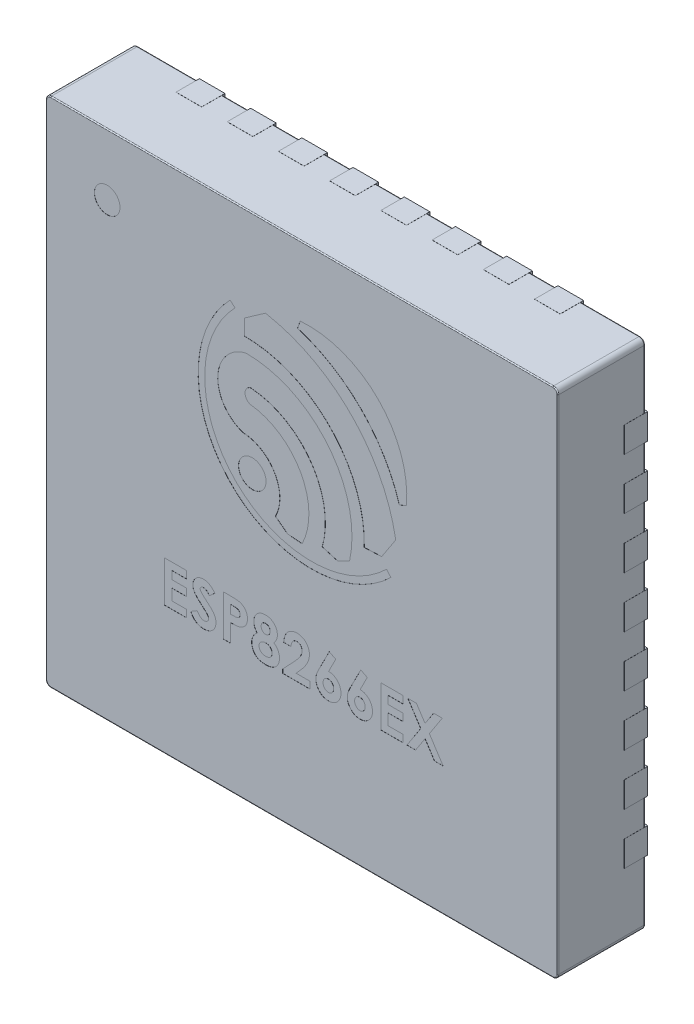
from build123d import *

# Parameters (mm, degrees)
SKETCH1_W                = 5
SKETCH1_H                = 5
BOSS_EXTRUDE1_DEPTH      = 0.85
FILLET1_R                = 0.05
FILLET2_R                = 0.01
BOSS_EXTRUDE2_DEPTH      = 0.025
BOSS_EXTRUDE2_DEPTH_BACK = 0.203
SKETCH2_W                = 0.25
SKETCH2_H                = 0.4
SKETCH2_W_2              = 0.4
SKETCH2_H_2              = 0.25
SKETCH3_R                = 0.125
SKETCH3_R_2              = 0.134340001
CUT_EXTRUDE1_DEPTH       = 0.001
BODY_MOVE_COPY1_ANGLE    = 180


with BuildPart() as part:
    # Sketch1 → Boss-Extrude1 (new body)
    with BuildSketch(Plane(origin=(0, 0, 0), x_dir=(1, 0, 0), z_dir=(0, 1, 0))):
        Rectangle(SKETCH1_W, SKETCH1_H)
    extrude(amount=BOSS_EXTRUDE1_DEPTH)

    # Fillet1
    fillet1_edges = [part.edges().sort_by_distance(p)[0] for p in [
        (2.5, 0.425, 2.5),
        (-2.5, 0.425, 2.5),
        (-2.5, 0.425, -2.5),
        (2.5, 0.425, -2.5),
    ]]
    fillet(fillet1_edges, radius=FILLET1_R)

    # Fillet2
    fillet2_edges = [part.edges().sort_by_distance(p)[0] for p in [
        (0, 0, -2.5),
        (0, 0.85, -2.5),
        (2.5, 0, 0),
        (0, 0, 2.5),
        (-2.5, 0, 0),
        (-2.485355339, 0, -2.485355339),
        (-2.485355339, 0, 2.485355339),
        (2.485355339, 0, 2.485355339),
        (2.485355339, 0, -2.485355339),
        (2.5, 0.85, 0),
        (-2.5, 0.85, 0),
        (0, 0.85, 2.5),
        (-2.485355339, 0.85, -2.485355339),
        (-2.485355339, 0.85, 2.485355339),
        (2.485355339, 0.85, 2.485355339),
        (2.485355339, 0.85, -2.485355339),
    ]]
    fillet(fillet2_edges, radius=FILLET2_R)

    # Sketch2 → Boss-Extrude2 (add, two sides: drawn at the far end of the back side and taken through both)
    with BuildSketch(Plane.XZ.offset(-BOSS_EXTRUDE2_DEPTH_BACK)):
        with BuildLine():
            Line((1.55, 1.85), (1.85, 1.55))
            Line((1.85, 1.55), (1.85, -1.8))
            ThreePointArc((1.85, -1.8), (1.835355339, -1.835355339), (1.8, -1.85))
            Line((1.8, -1.85), (-1.8, -1.85))
            ThreePointArc((-1.8, -1.85), (-1.835355339, -1.835355339), (-1.85, -1.8))
            Line((-1.85, -1.8), (-1.85, 1.8))
            ThreePointArc((-1.85, 1.8), (-1.835355339, 1.835355339), (-1.8, 1.85))
            Line((-1.8, 1.85), (1.55, 1.85))
        make_face()
        with Locations((-0.25, 2.301)):
            Rectangle(SKETCH2_W, SKETCH2_H)
        with Locations((-0.75, 2.301)):
            Rectangle(SKETCH2_W, SKETCH2_H)
        with Locations((-1.25, 2.301)):
            Rectangle(SKETCH2_W, SKETCH2_H)
        with Locations((-1.75, 2.301)):
            Rectangle(SKETCH2_W, SKETCH2_H)
        with Locations((1.75, 2.301)):
            Rectangle(SKETCH2_W, SKETCH2_H)
        with Locations((1.25, 2.301)):
            Rectangle(SKETCH2_W, SKETCH2_H)
        with Locations((0.75, 2.301)):
            Rectangle(SKETCH2_W, SKETCH2_H)
        with Locations((0.25, 2.301)):
            Rectangle(SKETCH2_W, SKETCH2_H)
        with Locations((0.25, -2.301)):
            Rectangle(SKETCH2_W, SKETCH2_H)
        with Locations((0.75, -2.301)):
            Rectangle(SKETCH2_W, SKETCH2_H)
        with Locations((1.25, -2.301)):
            Rectangle(SKETCH2_W, SKETCH2_H)
        with Locations((1.75, -2.301)):
            Rectangle(SKETCH2_W, SKETCH2_H)
        with Locations((-1.75, -2.301)):
            Rectangle(SKETCH2_W, SKETCH2_H)
        with Locations((-1.25, -2.301)):
            Rectangle(SKETCH2_W, SKETCH2_H)
        with Locations((-0.75, -2.301)):
            Rectangle(SKETCH2_W, SKETCH2_H)
        with Locations((-0.25, -2.301)):
            Rectangle(SKETCH2_W, SKETCH2_H)
        with Locations((2.301, 0.25)):
            Rectangle(SKETCH2_W_2, SKETCH2_H_2)
        with Locations((2.301, 0.75)):
            Rectangle(SKETCH2_W_2, SKETCH2_H_2)
        with Locations((2.301, 1.25)):
            Rectangle(SKETCH2_W_2, SKETCH2_H_2)
        with Locations((2.301, 1.75)):
            Rectangle(SKETCH2_W_2, SKETCH2_H_2)
        with Locations((2.301, -1.75)):
            Rectangle(SKETCH2_W_2, SKETCH2_H_2)
        with Locations((2.301, -1.25)):
            Rectangle(SKETCH2_W_2, SKETCH2_H_2)
        with Locations((2.301, -0.75)):
            Rectangle(SKETCH2_W_2, SKETCH2_H_2)
        with Locations((2.301, -0.25)):
            Rectangle(SKETCH2_W_2, SKETCH2_H_2)
        with Locations((-2.301, -0.25)):
            Rectangle(SKETCH2_W_2, SKETCH2_H_2)
        with Locations((-2.301, -0.75)):
            Rectangle(SKETCH2_W_2, SKETCH2_H_2)
        with Locations((-2.301, -1.25)):
            Rectangle(SKETCH2_W_2, SKETCH2_H_2)
        with Locations((-2.301, -1.75)):
            Rectangle(SKETCH2_W_2, SKETCH2_H_2)
        with Locations((-2.301, 1.75)):
            Rectangle(SKETCH2_W_2, SKETCH2_H_2)
        with Locations((-2.301, 1.25)):
            Rectangle(SKETCH2_W_2, SKETCH2_H_2)
        with Locations((-2.301, 0.75)):
            Rectangle(SKETCH2_W_2, SKETCH2_H_2)
        with Locations((-2.301, 0.25)):
            Rectangle(SKETCH2_W_2, SKETCH2_H_2)
    extrude(amount=BOSS_EXTRUDE2_DEPTH + BOSS_EXTRUDE2_DEPTH_BACK)

    # Sketch3 → Cut-Extrude1 (cut)
    # profile 1 of 15: a face of its own
    with BuildSketch(Plane(origin=(0, 0.85, 0), x_dir=(1, 0, 0), z_dir=(0, 1, 0))):
        with Locations(Location((1.9, -1.9, 0), (0, 0, 270))):
            Circle(SKETCH3_R)
    # profile 2 of 15: a face of its own
    with BuildSketch(Plane(origin=(0, 0.85, 0), x_dir=(1, 0, 0), z_dir=(0, 1, 0))):
        with Locations(Location((0.483594139, -0.295042575, 0), (0, 0, 270))):
            Circle(SKETCH3_R_2)
    # profile 3 of 15: a face of its own
    with BuildSketch(Plane(origin=(0, 0.85, 0), x_dir=(1, 0, 0), z_dir=(0, 1, 0))):
        with BuildLine():
            Line((-0.951785861, -0.747131021), (-1.020815861, -0.776531021))
            ThreePointArc((-1.020815861, -0.776531021), (-0.744879335, -1.538615836), (0.015772809, -1.818477493))
            Line((0.015772809, -1.818477493), (0.042084139, -1.745141021))
            ThreePointArc((0.042084139, -1.745141021), (-0.579273267, -1.370042291), (-0.951785861, -0.747131021))
        make_face()
    # profile 4 of 15: a face of its own
    with BuildSketch(Plane(origin=(0, 0.85, 0), x_dir=(1, 0, 0), z_dir=(0, 1, 0))):
        with BuildLine():
            Line((-0.608885862, -0.217240217), (-0.779015862, -0.224530217))
            Line((-0.779015862, -0.224530217), (-0.916505862, -0.434440217))
            ThreePointArc((-0.916505862, -0.434440217), (-0.482429799, -1.275536784), (0.355366094, -1.715949664))
            Line((0.355366094, -1.715949664), (0.561766094, -1.571139664))
            Line((0.561766094, -1.571139664), (0.561766094, -1.419009664))
            ThreePointArc((0.561766094, -1.419009664), (-0.277433802, -1.065425286), (-0.608885862, -0.217240217))
        make_face()
    # profile 5 of 15: a face of its own
    with BuildSketch(Plane(origin=(0, 0.85, 0), x_dir=(1, 0, 0), z_dir=(0, 1, 0))):
        with BuildLine():
            Line((0.652194139, -1.611641021), (0.700284139, -1.654181021))
            ThreePointArc((0.700284139, -1.654181021), (0.685311706, -0.099263955), (-0.869668762, -0.094067666))
            Line((-0.869668762, -0.094067666), (-0.826901773, -0.141962742))
            ThreePointArc((-0.826901773, -0.141962742), (0.64006638, -0.144720408), (0.652194139, -1.611641021))
        make_face()
    # profile 6 of 15: a face of its own
    with BuildSketch(Plane(origin=(0, 0.85, 0), x_dir=(1, 0, 0), z_dir=(0, 1, 0))):
        with BuildLine():
            Line((0.257726542, -0.047166837), (0.139346542, 0.042413163))
            Line((0.139346542, 0.042413163), (-0.002793458, 0.054923163))
            ThreePointArc((-0.002793458, 0.054923163), (0.010161928, -0.539574072), (0.504116848, -0.870638026))
            ThreePointArc((0.504116848, -0.870638026), (0.554404737, -0.94213728), (0.501462863, -1.011694256))
            ThreePointArc((0.501462863, -1.011694256), (-0.086844469, -0.682432252), (-0.198992375, -0.017645195))
            Line((-0.198992375, -0.017645195), (-0.349232375, 0.027084805))
            Line((-0.349232375, 0.027084805), (-0.466280352, -0.031499116))
            ThreePointArc((-0.466280352, -0.031499116), (-0.259791749, -0.898754897), (0.544527625, -1.283255195))
            ThreePointArc((0.544527625, -1.283255195), (0.820500189, -0.950984657), (0.574016431, -0.596287147))
            ThreePointArc((0.574016431, -0.596287147), (0.26490491, -0.408682802), (0.257726542, -0.047166837))
        make_face()
    # profile 7 of 15: a face of its own
    with BuildSketch(Plane(origin=(0, 0.85, 0), x_dir=(1, 0, 0), z_dir=(0, 1, 0))):
        Polygon((-1.034535256, 0.845), (-1.119150641, 0.845), (-1.202724359, 0.973445513), (-1.286458333, 0.845), (-1.371153846, 0.845), (-1.245032051, 1.038429487), (-1.379487179, 1.245), (-1.294871795, 1.245), (-1.202724359, 1.103333333), (-1.110336538, 1.245), (-1.025641026, 1.245), (-1.160416667, 1.038349359), align=None)
    # profile 8 of 15: a face of its own
    with BuildSketch(Plane(origin=(0, 0.85, 0), x_dir=(1, 0, 0), z_dir=(0, 1, 0))):
        Polygon((-0.771794872, 0.845), (-0.987179487, 0.845), (-0.987179487, 0.916794872), (-0.843589744, 0.916794872), (-0.843589744, 0.993717949), (-0.987179487, 0.993717949), (-0.987179487, 1.065512821), (-0.843589744, 1.065512821), (-0.843589744, 1.173205128), (-0.987179487, 1.173205128), (-0.987179487, 1.245), (-0.771794872, 1.245), align=None)
    # profile 9 of 15: a face of its own
    with BuildSketch(Plane(origin=(0, 0.85, 0), x_dir=(1, 0, 0), z_dir=(0, 1, 0))):
        with BuildLine():
            Line((-0.575320513, 0.83474359), (-0.638862179, 0.866955128))
            Line((-0.638862179, 0.866955128), (-0.569150641, 1.003974359))
            add(Edge.make_bspline(
                [(-0.569150641, 1.003974359), (-0.573269435, 1.004080212), (-0.581382076, 1.004288707), (-0.593312977, 1.005997299), (-0.604748106, 1.008892993), (-0.615686991, 1.012934092), (-0.626207755, 1.018011084), (-0.636259324, 1.024259257), (-0.645707861, 1.031826822), (-0.65472964, 1.040226728), (-0.662934783, 1.049528342), (-0.670061962, 1.059524346), (-0.676273288, 1.069970201), (-0.681101695, 1.081099959), (-0.684996456, 1.09272904), (-0.687806696, 1.104903955), (-0.689410017, 1.117659953), (-0.689631062, 1.12632568), (-0.68974359, 1.130737179)],
                knots=[0, 0, 0, 0, 1.013301021, 1.995862538, 2.958769729, 3.911210226, 4.860765807, 5.829243184, 6.816804824, 7.835209597, 8.859810738, 9.863084768, 10.852896952, 11.844649668, 12.842374562, 13.8676291, 14.914464604, 16, 16, 16, 16], degree=3))
            add(Edge.make_bspline(
                [(-0.68974359, 1.130737179), (-0.689637782, 1.134989455), (-0.689428647, 1.14339438), (-0.687710912, 1.155741551), (-0.684901826, 1.167603001), (-0.680987758, 1.178950557), (-0.6758446, 1.189745756), (-0.669797074, 1.200156632), (-0.662408424, 1.209950659), (-0.654060686, 1.219168683), (-0.644924818, 1.227601632), (-0.635232355, 1.235016234), (-0.625027455, 1.241214134), (-0.614441239, 1.246419225), (-0.60328236, 1.250308145), (-0.591712075, 1.253242307), (-0.579644191, 1.254935738), (-0.571452764, 1.255148664), (-0.567307692, 1.25525641)],
                knots=[0, 0, 0, 0, 1.049794856, 2.07499426, 3.07172498, 4.056334273, 5.03302406, 6.020611576, 7.024540571, 8.056592197, 9.088222165, 10.090850172, 11.06486348, 12.032490482, 12.998429859, 13.977500003, 14.976563331, 16, 16, 16, 16], degree=3))
            add(Edge.make_bspline(
                [(-0.567307692, 1.25525641), (-0.562973519, 1.255167196), (-0.554450954, 1.254991767), (-0.541975055, 1.253055996), (-0.530038648, 1.250086141), (-0.518593103, 1.246052568), (-0.507780989, 1.240577821), (-0.497510034, 1.234017592), (-0.487821261, 1.226220723), (-0.478777792, 1.217420685), (-0.470631959, 1.207777303), (-0.463366119, 1.197766021), (-0.457219317, 1.187369835), (-0.452243597, 1.176600195), (-0.448361432, 1.165491332), (-0.445660235, 1.154022185), (-0.443900156, 1.142223171), (-0.443693827, 1.134215692), (-0.443589744, 1.130176282)],
                knots=[0, 0, 0, 0, 1.063729824, 2.091680771, 3.092458079, 4.082252707, 5.065066109, 6.062289472, 7.070414589, 8.114214813, 9.156632944, 10.167081891, 11.149282074, 12.117871028, 13.076366051, 14.034232288, 15.008359245, 16, 16, 16, 16], degree=3))
            add(Edge.make_bspline(
                [(-0.443589744, 1.130176282), (-0.443644737, 1.127048231), (-0.443755031, 1.120774716), (-0.444863486, 1.111380483), (-0.446548568, 1.10196153), (-0.448502302, 1.094013716), (-0.450512838, 1.087292523), (-0.45254048, 1.081606191), (-0.455026038, 1.07531108), (-0.457955206, 1.068384327), (-0.461206501, 1.060771365), (-0.464986073, 1.052561472), (-0.46917084, 1.043689163), (-0.472160237, 1.037597378), (-0.473717949, 1.034423077)],
                knots=[0, 0, 0, 0, 1.110459156, 2.227099586, 3.354645278, 4.50724841, 5.131424341, 5.845429508, 6.650417918, 7.534765369, 8.5162346, 9.590157747, 10.744282107, 12, 12, 12, 12], degree=3))
            Line((-0.473717949, 1.034423077), (-0.575320513, 0.83474359))
        make_face()
        with BuildLine():
            add(Edge.make_bspline(
                [(-0.565705128, 1.070641026), (-0.562260477, 1.070799358), (-0.555519748, 1.071109194), (-0.545930592, 1.074342833), (-0.537222315, 1.079431029), (-0.529594971, 1.086419489), (-0.523262298, 1.094894764), (-0.518644785, 1.104580774), (-0.51582257, 1.11530185), (-0.515533725, 1.12278674), (-0.515384615, 1.126650641)],
                knots=[0, 0, 0, 0, 0.981531227, 1.92072777, 2.858278205, 3.847411092, 4.856727683, 5.864107753, 6.897395173, 8, 8, 8, 8], degree=3))
            add(Edge.make_bspline(
                [(-0.515384615, 1.126650641), (-0.515565597, 1.130513946), (-0.515917617, 1.138028333), (-0.518777299, 1.148842121), (-0.523687846, 1.158621674), (-0.530344764, 1.167158902), (-0.538058328, 1.174406999), (-0.546773681, 1.17963065), (-0.556161705, 1.182869927), (-0.562661724, 1.183262973), (-0.565945513, 1.183461538)],
                knots=[0, 0, 0, 0, 1.098824389, 2.137286887, 3.15751972, 4.193305908, 5.205115386, 6.153224686, 7.067015188, 8, 8, 8, 8], degree=3))
            add(Edge.make_bspline(
                [(-0.565945513, 1.183461538), (-0.56941302, 1.18325884), (-0.576213404, 1.182861313), (-0.586023703, 1.179766648), (-0.594984267, 1.174595406), (-0.602911865, 1.167508929), (-0.609688285, 1.159052236), (-0.614460726, 1.149159341), (-0.617451173, 1.1382561), (-0.617779529, 1.130597057), (-0.617948718, 1.126650641)],
                knots=[0, 0, 0, 0, 0.969156912, 1.90068503, 2.84824055, 3.843957741, 4.860802806, 5.860356532, 6.897522282, 8, 8, 8, 8], degree=3))
            add(Edge.make_bspline(
                [(-0.617948718, 1.126650641), (-0.617773404, 1.122785442), (-0.617433578, 1.115293221), (-0.614522926, 1.104576059), (-0.609832771, 1.09486558), (-0.603320953, 1.086391424), (-0.595435043, 1.079370329), (-0.58634014, 1.074342684), (-0.576337943, 1.07110007), (-0.56930973, 1.070796645), (-0.565705128, 1.070641026)],
                knots=[0, 0, 0, 0, 1.083267085, 2.099782405, 3.092211101, 4.09231173, 5.080341908, 6.03348511, 6.991421775, 8, 8, 8, 8], degree=3))
        make_face(mode=Mode.SUBTRACT)
    # profile 10 of 15: a face of its own
    with BuildSketch(Plane(origin=(0, 0.85, 0), x_dir=(1, 0, 0), z_dir=(0, 1, 0))):
        with BuildLine():
            Line((-0.267628205, 0.83474359), (-0.331169872, 0.866955128))
            Line((-0.331169872, 0.866955128), (-0.261458333, 1.003974359))
            add(Edge.make_bspline(
                [(-0.261458333, 1.003974359), (-0.265577128, 1.004080212), (-0.273689768, 1.004288707), (-0.285620669, 1.005997299), (-0.297055799, 1.008892993), (-0.307994684, 1.012934092), (-0.318515447, 1.018011084), (-0.328567017, 1.024259257), (-0.338015554, 1.031826822), (-0.347037332, 1.040226728), (-0.355242475, 1.049528342), (-0.362369654, 1.059524346), (-0.36858098, 1.069970201), (-0.373409387, 1.081099959), (-0.377304149, 1.09272904), (-0.380114389, 1.104903955), (-0.381717709, 1.117659953), (-0.381938754, 1.12632568), (-0.382051282, 1.130737179)],
                knots=[0, 0, 0, 0, 1.013301021, 1.995862538, 2.958769729, 3.911210226, 4.860765807, 5.829243184, 6.816804824, 7.835209597, 8.859810738, 9.863084768, 10.852896952, 11.844649668, 12.842374562, 13.8676291, 14.914464604, 16, 16, 16, 16], degree=3))
            add(Edge.make_bspline(
                [(-0.382051282, 1.130737179), (-0.381945475, 1.134989455), (-0.381736339, 1.14339438), (-0.380018604, 1.155741551), (-0.377209518, 1.167603001), (-0.37329545, 1.178950557), (-0.368152292, 1.189745756), (-0.362104766, 1.200156632), (-0.354716117, 1.209950659), (-0.346368378, 1.219168683), (-0.337232511, 1.227601632), (-0.327540047, 1.235016234), (-0.317335147, 1.241214134), (-0.306748932, 1.246419225), (-0.295590053, 1.250308145), (-0.284019767, 1.253242307), (-0.271951884, 1.254935738), (-0.263760456, 1.255148664), (-0.259615385, 1.25525641)],
                knots=[0, 0, 0, 0, 1.049794856, 2.07499426, 3.07172498, 4.056334273, 5.03302406, 6.020611576, 7.024540571, 8.056592197, 9.088222165, 10.090850172, 11.06486348, 12.032490482, 12.998429859, 13.977500003, 14.976563331, 16, 16, 16, 16], degree=3))
            add(Edge.make_bspline(
                [(-0.259615385, 1.25525641), (-0.255281211, 1.255167196), (-0.246758646, 1.254991767), (-0.234282747, 1.253055996), (-0.22234634, 1.250086141), (-0.210900795, 1.246052568), (-0.200088682, 1.240577821), (-0.189817727, 1.234017592), (-0.180128953, 1.226220723), (-0.171085484, 1.217420685), (-0.162939651, 1.207777303), (-0.155673811, 1.197766021), (-0.149527009, 1.187369835), (-0.144551289, 1.176600195), (-0.140669124, 1.165491332), (-0.137967927, 1.154022185), (-0.136207849, 1.142223171), (-0.13600152, 1.134215692), (-0.135897436, 1.130176282)],
                knots=[0, 0, 0, 0, 1.063729824, 2.091680771, 3.092458079, 4.082252707, 5.065066109, 6.062289472, 7.070414589, 8.114214813, 9.156632944, 10.167081891, 11.149282074, 12.117871028, 13.076366051, 14.034232288, 15.008359245, 16, 16, 16, 16], degree=3))
            add(Edge.make_bspline(
                [(-0.135897436, 1.130176282), (-0.13595243, 1.127048231), (-0.136062723, 1.120774716), (-0.137171179, 1.111380483), (-0.13885626, 1.10196153), (-0.140809995, 1.094013716), (-0.14282053, 1.087292523), (-0.144848173, 1.081606191), (-0.147333731, 1.07531108), (-0.150262898, 1.068384327), (-0.153514193, 1.060771365), (-0.157293766, 1.052561472), (-0.161478532, 1.043689163), (-0.164467929, 1.037597378), (-0.166025641, 1.034423077)],
                knots=[0, 0, 0, 0, 1.110459156, 2.227099586, 3.354645278, 4.50724841, 5.131424341, 5.845429508, 6.650417918, 7.534765369, 8.5162346, 9.590157747, 10.744282107, 12, 12, 12, 12], degree=3))
            Line((-0.166025641, 1.034423077), (-0.267628205, 0.83474359))
        make_face()
        with BuildLine():
            add(Edge.make_bspline(
                [(-0.258012821, 1.070641026), (-0.25456817, 1.070799358), (-0.24782744, 1.071109194), (-0.238238284, 1.074342833), (-0.229530007, 1.079431029), (-0.221902663, 1.086419489), (-0.21556999, 1.094894764), (-0.210952477, 1.104580774), (-0.208130262, 1.11530185), (-0.207841417, 1.12278674), (-0.207692308, 1.126650641)],
                knots=[0, 0, 0, 0, 0.981531227, 1.92072777, 2.858278205, 3.847411092, 4.856727683, 5.864107753, 6.897395173, 8, 8, 8, 8], degree=3))
            add(Edge.make_bspline(
                [(-0.207692308, 1.126650641), (-0.207873289, 1.130513946), (-0.208225309, 1.138028333), (-0.211084991, 1.148842121), (-0.215995539, 1.158621674), (-0.222652456, 1.167158902), (-0.230366021, 1.174406999), (-0.239081374, 1.17963065), (-0.248469397, 1.182869927), (-0.254969417, 1.183262973), (-0.258253205, 1.183461538)],
                knots=[0, 0, 0, 0, 1.098824389, 2.137286887, 3.15751972, 4.193305908, 5.205115386, 6.153224686, 7.067015188, 8, 8, 8, 8], degree=3))
            add(Edge.make_bspline(
                [(-0.258253205, 1.183461538), (-0.261720712, 1.18325884), (-0.268521096, 1.182861313), (-0.278331396, 1.179766648), (-0.28729196, 1.174595406), (-0.295219558, 1.167508929), (-0.301995977, 1.159052236), (-0.306768418, 1.149159341), (-0.309758866, 1.1382561), (-0.310087221, 1.130597057), (-0.31025641, 1.126650641)],
                knots=[0, 0, 0, 0, 0.969156912, 1.90068503, 2.84824055, 3.843957741, 4.860802806, 5.860356532, 6.897522282, 8, 8, 8, 8], degree=3))
            add(Edge.make_bspline(
                [(-0.31025641, 1.126650641), (-0.310081096, 1.122785442), (-0.30974127, 1.115293221), (-0.306830618, 1.104576059), (-0.302140463, 1.09486558), (-0.295628646, 1.086391424), (-0.287742735, 1.079370329), (-0.278647833, 1.074342684), (-0.268645635, 1.07110007), (-0.261617422, 1.070796645), (-0.258012821, 1.070641026)],
                knots=[0, 0, 0, 0, 1.083267085, 2.099782405, 3.092211101, 4.09231173, 5.080341908, 6.03348511, 6.991421775, 8, 8, 8, 8], degree=3))
        make_face(mode=Mode.SUBTRACT)
    # profile 11 of 15: a face of its own
    with BuildSketch(Plane(origin=(0, 0.85, 0), x_dir=(1, 0, 0), z_dir=(0, 1, 0))):
        with BuildLine():
            Line((0.105128205, 0.978333333), (0.176923077, 0.978333333))
            add(Edge.make_bspline(
                [(0.176923077, 0.978333333), (0.176613128, 0.972902374), (0.176007505, 0.962290606), (0.17359585, 0.946877627), (0.170372619, 0.932310492), (0.16603407, 0.918632998), (0.160690174, 0.905839397), (0.154207927, 0.893972067), (0.146780866, 0.882945974), (0.138259285, 0.872954494), (0.128989033, 0.863971849), (0.118993876, 0.856118985), (0.108302207, 0.849545111), (0.096985518, 0.844152532), (0.085088261, 0.839837774), (0.07249023, 0.836954528), (0.059302586, 0.835001543), (0.050274496, 0.834830677), (0.045673077, 0.83474359)],
                knots=[0, 0, 0, 0, 1.198928049, 2.342633425, 3.435730849, 4.486331048, 5.502589352, 6.488331875, 7.46361919, 8.428949135, 9.378681775, 10.305958057, 11.226249248, 12.140413166, 13.066341608, 14.010670971, 14.986082777, 16, 16, 16, 16], degree=3))
            add(Edge.make_bspline(
                [(0.045673077, 0.83474359), (0.040022489, 0.834908269), (0.028986369, 0.835229903), (0.013001224, 0.838326648), (-0.002022881, 0.843096849), (-0.015937477, 0.84995776), (-0.028669636, 0.858648889), (-0.040068, 0.869122818), (-0.050184881, 0.881251069), (-0.058686761, 0.894944996), (-0.06560187, 0.909496014), (-0.070594736, 0.924454365), (-0.073837684, 0.939518448), (-0.074185958, 0.949658233), (-0.074358974, 0.954695513)],
                knots=[0, 0, 0, 0, 1.075206757, 2.099977874, 3.089436832, 4.070080219, 5.043757236, 6.01602434, 7.009399377, 8.042659726, 9.078134622, 10.07077983, 11.041594984, 12, 12, 12, 12], degree=3))
            add(Edge.make_bspline(
                [(-0.074358974, 0.954695513), (-0.074291866, 0.957742592), (-0.074156793, 0.963875609), (-0.073217616, 0.97315637), (-0.071808665, 0.98260991), (-0.069684309, 0.992228123), (-0.067035066, 1.002013708), (-0.06382114, 1.01199594), (-0.059968032, 1.022118258), (-0.055539849, 1.032494456), (-0.050257655, 1.043158745), (-0.044104649, 1.054268824), (-0.036911051, 1.065855264), (-0.02874709, 1.077881992), (-0.019670277, 1.090442279), (-0.009542452, 1.103387367), (0.001506671, 1.116863405), (0.009351129, 1.125869628), (0.01338141, 1.130496795)],
                knots=[0, 0, 0, 0, 0.728286467, 1.465860763, 2.227952348, 3.011875114, 3.818782069, 4.650637576, 5.517456182, 6.406927181, 7.346324104, 8.360844784, 9.441645378, 10.605053135, 11.834886952, 13.145197974, 14.533275831, 16, 16, 16, 16], degree=3))
            Line((0.01338141, 1.130496795), (0.055128205, 1.178333333))
            Line((0.055128205, 1.178333333), (-0.079487179, 1.178333333))
            Line((-0.079487179, 1.178333333), (-0.079487179, 1.245))
            Line((-0.079487179, 1.245), (0.187179487, 1.245))
            Line((0.187179487, 1.245), (0.187179487, 1.208621795))
            Line((0.187179487, 1.208621795), (0.06875, 1.082580128))
            add(Edge.make_bspline(
                [(0.06875, 1.082580128), (0.065321108, 1.07890349), (0.05868036, 1.071782933), (0.049232143, 1.061325039), (0.040679194, 1.05140289), (0.033212757, 1.041901421), (0.02638109, 1.03314234), (0.020665898, 1.024794519), (0.015688667, 1.017093049), (0.010489422, 1.007705263), (0.005438219, 0.996593223), (0.000806346, 0.983799609), (-0.001988799, 0.971563287), (-0.002377588, 0.963575561), (-0.002564103, 0.95974359)],
                knots=[0, 0, 0, 0, 1.246192343, 2.413505005, 3.49357156, 4.492416076, 5.408771964, 6.246246772, 6.999304986, 7.680960093, 8.904522682, 10.020616941, 11.0504258, 12, 12, 12, 12], degree=3))
            add(Edge.make_bspline(
                [(-0.002564103, 0.95974359), (-0.00242719, 0.956035218), (-0.0021619, 0.948849653), (0.000826092, 0.938657963), (0.005296866, 0.929360403), (0.011787583, 0.921380503), (0.019621712, 0.914765908), (0.028726271, 0.909918813), (0.038934094, 0.907069945), (0.046082326, 0.906719), (0.049759615, 0.906538462)],
                knots=[0, 0, 0, 0, 1.061596218, 2.057012874, 3.024113775, 4.006148568, 4.986025304, 5.949989669, 6.945406325, 8, 8, 8, 8], degree=3))
            add(Edge.make_bspline(
                [(0.049759615, 0.906538462), (0.051658975, 0.906605641), (0.05539817, 0.906737894), (0.060894493, 0.90761827), (0.06612464, 0.90916984), (0.071146824, 0.911248725), (0.075907449, 0.914004302), (0.080394504, 0.91740099), (0.084655269, 0.921352471), (0.0886702, 0.925846389), (0.092324312, 0.930861604), (0.09556988, 0.93635231), (0.098253425, 0.942315101), (0.100616115, 0.948671257), (0.102438335, 0.955489049), (0.103765138, 0.962727675), (0.104773817, 0.970375356), (0.105007927, 0.975632418), (0.105128205, 0.978333333)],
                knots=[0, 0, 0, 0, 0.903469896, 1.778625579, 2.63899355, 3.493148037, 4.358286772, 5.247621495, 6.164656832, 7.118446693, 8.109501108, 9.111810964, 10.146451449, 11.215617525, 12.33435995, 13.498009769, 14.714554818, 16, 16, 16, 16], degree=3))
        make_face()
    # profile 12 of 15: a face of its own
    with BuildSketch(Plane(origin=(0, 0.85, 0), x_dir=(1, 0, 0), z_dir=(0, 1, 0))):
        with BuildLine():
            add(Edge.make_bspline(
                [(0.27275641, 1.029615385), (0.26856117, 1.032611819), (0.26025707, 1.038542989), (0.24931809, 1.049166136), (0.239834542, 1.060978078), (0.231942962, 1.073940436), (0.225638441, 1.087813959), (0.221305832, 1.102411983), (0.218408632, 1.117508649), (0.218103147, 1.127785556), (0.217948718, 1.132980769)],
                knots=[0, 0, 0, 0, 1.013470425, 2.00607327, 2.989559212, 3.987547927, 4.985093546, 5.979490292, 6.978585884, 8, 8, 8, 8], degree=3))
            add(Edge.make_bspline(
                [(0.217948718, 1.132980769), (0.218138358, 1.138605423), (0.218514484, 1.149761203), (0.221848186, 1.166119166), (0.227172427, 1.181819559), (0.234517309, 1.196676855), (0.243683849, 1.210281748), (0.254305677, 1.222422273), (0.266541345, 1.232562724), (0.277841449, 1.239541116), (0.28763571, 1.244068465), (0.295475921, 1.247159249), (0.303889765, 1.249595539), (0.312736872, 1.251691005), (0.322109554, 1.253262057), (0.331915539, 1.254498783), (0.34224676, 1.255098542), (0.349278274, 1.255202891), (0.352884615, 1.25525641)],
                knots=[0, 0, 0, 0, 1.313633616, 2.605423678, 3.884827599, 5.180399172, 6.467003699, 7.709825993, 8.937691468, 10.168030689, 10.802071053, 11.45831639, 12.135866991, 12.84764728, 13.582572811, 14.35620613, 15.156926628, 16, 16, 16, 16], degree=3))
            add(Edge.make_bspline(
                [(0.352884615, 1.25525641), (0.3567314, 1.255203935), (0.364243411, 1.255101461), (0.375210441, 1.254489406), (0.385551292, 1.253339218), (0.395312819, 1.251892113), (0.404405502, 1.249743212), (0.412950138, 1.247407034), (0.420854297, 1.244504849), (0.430516154, 1.240028681), (0.441715664, 1.233334421), (0.453668451, 1.223326268), (0.464318427, 1.211591801), (0.473237986, 1.198046978), (0.480670363, 1.183267583), (0.485974629, 1.167327916), (0.48916949, 1.150443239), (0.489549946, 1.138870869), (0.48974359, 1.132980769)],
                knots=[0, 0, 0, 0, 0.887187828, 1.732502891, 2.531768656, 3.28622382, 4.00645991, 4.68503301, 5.328123524, 5.945476897, 7.13918604, 8.324554323, 9.528234031, 10.780485522, 12.053158567, 13.332907357, 14.642504384, 16, 16, 16, 16], degree=3))
            add(Edge.make_bspline(
                [(0.48974359, 1.132980769), (0.489611465, 1.1278403), (0.489351672, 1.11773271), (0.486649564, 1.102980157), (0.48252981, 1.088870262), (0.476508768, 1.075532904), (0.468949407, 1.062806695), (0.459533597, 1.050952752), (0.448582661, 1.039680894), (0.440248958, 1.033026207), (0.435977564, 1.029615385)],
                knots=[0, 0, 0, 0, 1.017680362, 2.001042016, 2.962316111, 3.924347734, 4.892953533, 5.888308623, 6.917664266, 8, 8, 8, 8], degree=3))
            add(Edge.make_bspline(
                [(0.435977564, 1.029615385), (0.438625737, 1.026562761), (0.443839191, 1.020553065), (0.450567966, 1.010872929), (0.456310083, 1.00091206), (0.460943535, 0.99061154), (0.464668854, 0.980090117), (0.467348536, 0.969283041), (0.46887244, 0.958157926), (0.469110517, 0.950640164), (0.469230769, 0.946842949)],
                knots=[0, 0, 0, 0, 1.06167017, 2.090108827, 3.093337593, 4.079993162, 5.054811602, 6.023746282, 7.001795783, 8, 8, 8, 8], degree=3))
            add(Edge.make_bspline(
                [(0.469230769, 0.946842949), (0.469072578, 0.941702255), (0.468760473, 0.931559864), (0.46594516, 0.916714316), (0.461375071, 0.902558838), (0.454927846, 0.889279591), (0.446993983, 0.877001848), (0.437389132, 0.866148286), (0.426396485, 0.856664209), (0.413951394, 0.848746049), (0.400273318, 0.842489072), (0.385512512, 0.837991374), (0.369737075, 0.835199163), (0.358852621, 0.834897758), (0.353285256, 0.83474359)],
                knots=[0, 0, 0, 0, 1.022461855, 2.017277858, 2.995792987, 3.975491763, 4.947267477, 5.896545572, 6.850353789, 7.828175386, 8.82259352, 9.83498435, 10.892601059, 12, 12, 12, 12], degree=3))
            add(Edge.make_bspline(
                [(0.353285256, 0.83474359), (0.347798044, 0.834897561), (0.337099128, 0.835197774), (0.321576599, 0.837982117), (0.30708779, 0.84257513), (0.293652617, 0.848914793), (0.281380671, 0.856924995), (0.270583142, 0.86669615), (0.261017444, 0.87783403), (0.252992891, 0.89040223), (0.246535446, 0.903943454), (0.241818267, 0.918171139), (0.239051832, 0.93292693), (0.23865909, 0.942932094), (0.238461538, 0.947964744)],
                knots=[0, 0, 0, 0, 1.094374825, 2.133801765, 3.135215957, 4.120034135, 5.089936793, 6.048819145, 7.016727444, 8.011879177, 9.015716645, 10.003559944, 10.995780443, 12, 12, 12, 12], degree=3))
            add(Edge.make_bspline(
                [(0.238461538, 0.947964744), (0.238557299, 0.951521243), (0.238745223, 0.958500608), (0.240129598, 0.96878469), (0.242474296, 0.978646438), (0.245698973, 0.988362906), (0.250369097, 0.998063029), (0.25633902, 1.008215217), (0.26393052, 1.018839522), (0.269721791, 1.025910304), (0.27275641, 1.029615385)],
                knots=[0, 0, 0, 0, 0.940860718, 1.84636882, 2.739437118, 3.619946589, 4.54937856, 5.582024627, 6.73298378, 8, 8, 8, 8], degree=3))
        make_face()
        with BuildLine():
            add(Edge.make_bspline(
                [(0.355048077, 0.906538462), (0.358003429, 0.90668361), (0.363777881, 0.906967214), (0.371978998, 0.909438485), (0.379365452, 0.913488143), (0.385741234, 0.919111565), (0.390921379, 0.92600902), (0.394794331, 0.933870968), (0.397069155, 0.942657059), (0.397311273, 0.948806082), (0.397435897, 0.951971154)],
                knots=[0, 0, 0, 0, 1.017635784, 1.98835473, 2.924394675, 3.903775679, 4.896969949, 5.881752986, 6.909679918, 8, 8, 8, 8], degree=3))
            add(Edge.make_bspline(
                [(0.397435897, 0.951971154), (0.397280521, 0.955162741), (0.396977132, 0.961394622), (0.394643846, 0.970368411), (0.390520217, 0.978449233), (0.384989004, 0.985524795), (0.378439654, 0.991500555), (0.370839973, 0.995745402), (0.362522154, 0.998460232), (0.356671931, 0.99871574), (0.353685897, 0.998846154)],
                knots=[0, 0, 0, 0, 1.071109905, 2.091445327, 3.086230388, 4.096303754, 5.093673306, 6.041538876, 7.0003745, 8, 8, 8, 8], degree=3))
            add(Edge.make_bspline(
                [(0.353685897, 0.998846154), (0.350649985, 0.998707864), (0.344735458, 0.998438451), (0.336291518, 0.995872311), (0.328763734, 0.991577831), (0.322192538, 0.985817209), (0.316871067, 0.978682386), (0.31296402, 0.970472411), (0.310713689, 0.961223234), (0.310412565, 0.954761257), (0.31025641, 0.951410256)],
                knots=[0, 0, 0, 0, 1.008985882, 1.965693801, 2.905634363, 3.876216071, 4.854591133, 5.849205062, 6.884658104, 8, 8, 8, 8], degree=3))
            add(Edge.make_bspline(
                [(0.31025641, 0.951410256), (0.310404909, 0.948243415), (0.310692425, 0.942111971), (0.313066246, 0.933383369), (0.316992521, 0.925589081), (0.322375022, 0.91882569), (0.329073178, 0.913344456), (0.336864244, 0.909318343), (0.345673955, 0.906982051), (0.351855704, 0.906689527), (0.355048077, 0.906538462)],
                knots=[0, 0, 0, 0, 1.066147256, 2.064208482, 3.022454516, 3.989792431, 4.955788801, 5.918128389, 6.924881755, 8, 8, 8, 8], degree=3))
        make_face(mode=Mode.SUBTRACT)
        with BuildLine():
            add(Edge.make_bspline(
                [(0.352724359, 1.070641026), (0.354970928, 1.070677485), (0.359398887, 1.070749345), (0.365903617, 1.071609285), (0.372171368, 1.072830096), (0.378092319, 1.074732095), (0.383823328, 1.076953987), (0.389219729, 1.07985548), (0.394373984, 1.083225946), (0.399174873, 1.087066542), (0.40351511, 1.09127786), (0.407427085, 1.095671161), (0.410624655, 1.100358767), (0.413287447, 1.105185175), (0.415427021, 1.110188552), (0.41684144, 1.115451314), (0.417752128, 1.12090337), (0.417882803, 1.12461709), (0.417948718, 1.126490385)],
                knots=[0, 0, 0, 0, 1.129662435, 2.226550525, 3.296682235, 4.33815786, 5.351414921, 6.385493299, 7.41431807, 8.4469981, 9.473537958, 10.454642902, 11.401552439, 12.321859429, 13.225429467, 14.131893492, 15.057679712, 16, 16, 16, 16], degree=3))
            add(Edge.make_bspline(
                [(0.417948718, 1.126490385), (0.417917154, 1.12844397), (0.417854551, 1.132318664), (0.416915575, 1.137975416), (0.415552728, 1.143425875), (0.413674263, 1.148654612), (0.411013158, 1.153555788), (0.407997283, 1.158320725), (0.404353676, 1.162820064), (0.400216392, 1.167025008), (0.395652747, 1.170897204), (0.3906634, 1.174244406), (0.385353181, 1.177178831), (0.379644221, 1.179488347), (0.373595055, 1.18124093), (0.367242365, 1.182510037), (0.360546207, 1.18335612), (0.355958898, 1.183425797), (0.353605769, 1.183461538)],
                knots=[0, 0, 0, 0, 0.974019005, 1.931846162, 2.853358636, 3.777086404, 4.695411081, 5.630991801, 6.588726176, 7.578582455, 8.572023234, 9.570371685, 10.572628972, 11.595075622, 12.6370648, 13.711634473, 14.826148828, 16, 16, 16, 16], degree=3))
            add(Edge.make_bspline(
                [(0.353605769, 1.183461538), (0.351226625, 1.183418414), (0.346590426, 1.183334377), (0.339813237, 1.182591652), (0.333403212, 1.181413169), (0.327368043, 1.179727641), (0.321684775, 1.177568491), (0.316430126, 1.174820036), (0.311482364, 1.171706273), (0.307006863, 1.168064773), (0.302929351, 1.164135787), (0.299466398, 1.159775774), (0.296352701, 1.155262206), (0.294009969, 1.150303803), (0.292003553, 1.145188532), (0.290811041, 1.139721727), (0.28981991, 1.134031307), (0.289769398, 1.130101054), (0.28974359, 1.128092949)],
                knots=[0, 0, 0, 0, 1.200730299, 2.339843079, 3.437336227, 4.487507367, 5.49914389, 6.500211663, 7.47645343, 8.445123332, 9.408146062, 10.328401978, 11.252108805, 12.168702489, 13.09034032, 14.019150537, 14.98791428, 16, 16, 16, 16], degree=3))
            add(Edge.make_bspline(
                [(0.28974359, 1.128092949), (0.289816935, 1.126087703), (0.289960299, 1.122168144), (0.290743661, 1.116379468), (0.29221668, 1.110893739), (0.294132244, 1.105574129), (0.296717248, 1.100579318), (0.299772709, 1.095756379), (0.303506984, 1.091312179), (0.307634853, 1.087046148), (0.312274703, 1.083229016), (0.317253364, 1.079881186), (0.322438553, 1.076935125), (0.327997044, 1.074735287), (0.333755401, 1.072829204), (0.339864738, 1.07160935), (0.346209447, 1.070749148), (0.350531121, 1.070677425), (0.352724359, 1.070641026)],
                knots=[0, 0, 0, 0, 1.011607766, 1.977342622, 2.937803287, 3.871057497, 4.822789971, 5.768019373, 6.744124207, 7.744188914, 8.758214762, 9.766859222, 10.76764927, 11.758144632, 12.776187854, 13.822267547, 14.894806271, 16, 16, 16, 16], degree=3))
        make_face(mode=Mode.SUBTRACT)
    # profile 13 of 15: a face of its own
    with BuildSketch(Plane(origin=(0, 0.85, 0), x_dir=(1, 0, 0), z_dir=(0, 1, 0))):
        with BuildLine():
            Line((0.766666667, 0.845), (0.686538462, 0.845))
            add(Edge.make_bspline(
                [(0.686538462, 0.845), (0.681302989, 0.845023435), (0.671202664, 0.845068646), (0.656637165, 0.845616893), (0.643199777, 0.846599381), (0.630893596, 0.84781359), (0.619723654, 0.849515835), (0.609676051, 0.85146741), (0.600748425, 0.853844722), (0.592840986, 0.856667434), (0.585742127, 0.859992389), (0.57903221, 0.86354381), (0.572812224, 0.867753469), (0.566936141, 0.872317926), (0.561448411, 0.877332141), (0.556308369, 0.882776297), (0.551568943, 0.888729512), (0.547259846, 0.895150775), (0.543348684, 0.901909353), (0.539932199, 0.909020659), (0.537160793, 0.916495039), (0.534835968, 0.924284388), (0.532968636, 0.9323883), (0.531725683, 0.940856632), (0.530881405, 0.94963025), (0.53080691, 0.95560158), (0.530769231, 0.958621795)],
                knots=[0, 0, 0, 0, 1.698787518, 3.27731721, 4.728409951, 6.070286353, 7.288646904, 8.393455548, 9.389990496, 10.283725379, 11.113616976, 11.931887102, 12.744353494, 13.547053751, 14.344590688, 15.153907614, 15.974148981, 16.810666655, 17.660988447, 18.506082349, 19.367288142, 20.244738011, 21.142497992, 22.06302001, 23.020302899, 24, 24, 24, 24], degree=3))
            add(Edge.make_bspline(
                [(0.530769231, 0.958621795), (0.530823511, 0.961963083), (0.530930179, 0.968529125), (0.531983765, 0.978152487), (0.533765847, 0.987333736), (0.536151556, 0.996112095), (0.539263382, 1.004468359), (0.543163541, 1.012347634), (0.547624788, 1.019848654), (0.552891468, 1.026834224), (0.558711166, 1.033339904), (0.564977651, 1.039436491), (0.571878951, 1.044873405), (0.579168737, 1.049933305), (0.587055591, 1.054319194), (0.595305841, 1.058380345), (0.604128736, 1.061826603), (0.61026855, 1.063634623), (0.61338141, 1.064551282)],
                knots=[0, 0, 0, 0, 1.101767505, 2.165108537, 3.187936629, 4.183892551, 5.162396277, 6.123736501, 7.080098904, 8.036826416, 9.0040019, 9.957275584, 10.916231297, 11.898534744, 12.880877694, 13.889532316, 14.930001539, 16, 16, 16, 16], degree=3))
            add(Edge.make_bspline(
                [(0.61338141, 1.064551282), (0.61543195, 1.06506146), (0.619874079, 1.066166668), (0.627224582, 1.067288733), (0.635695265, 1.068320402), (0.64531352, 1.069206997), (0.656084891, 1.069809675), (0.667998949, 1.070280339), (0.681061093, 1.070622561), (0.690143991, 1.070634705), (0.694871795, 1.070641026)],
                knots=[0, 0, 0, 0, 0.618981996, 1.340914327, 2.176866532, 3.120127938, 4.170906482, 5.338178032, 6.614476169, 8, 8, 8, 8], degree=3))
            Line((0.694871795, 1.070641026), (0.694871795, 1.245))
            Line((0.694871795, 1.245), (0.766666667, 1.245))
            Line((0.766666667, 1.245), (0.766666667, 0.845))
        make_face()
        with BuildLine():
            Line((0.694871795, 0.998846154), (0.669471154, 0.998846154))
            add(Edge.make_bspline(
                [(0.669471154, 0.998846154), (0.664849031, 0.998816956), (0.656344255, 0.99876323), (0.644730785, 0.997982188), (0.635394915, 0.996794697), (0.628027505, 0.995077659), (0.622207991, 0.992520984), (0.617249164, 0.989437369), (0.612843555, 0.985731846), (0.609171134, 0.981289502), (0.606178466, 0.97633326), (0.604079444, 0.970825696), (0.602754631, 0.964854826), (0.602628808, 0.960685695), (0.602564103, 0.958541667)],
                knots=[0, 0, 0, 0, 1.862351722, 3.426754836, 4.68713255, 5.653025869, 6.462861518, 7.236406327, 7.999926698, 8.771672214, 9.54880311, 10.322347919, 11.137246204, 12, 12, 12, 12], degree=3))
            add(Edge.make_bspline(
                [(0.602564103, 0.958541667), (0.602626791, 0.956667989), (0.60274842, 0.953032603), (0.60365426, 0.947789529), (0.60506017, 0.942911489), (0.60720883, 0.938466481), (0.609817499, 0.93435083), (0.61312692, 0.930692655), (0.616943362, 0.927373604), (0.619894775, 0.92561899), (0.621394231, 0.924727564)],
                knots=[0, 0, 0, 0, 1.102449765, 2.139017612, 3.12397484, 4.080535277, 5.035673127, 5.982361139, 6.974944601, 8, 8, 8, 8], degree=3))
            add(Edge.make_bspline(
                [(0.621394231, 0.924727564), (0.622664036, 0.924085387), (0.625352473, 0.922725767), (0.629931142, 0.92114511), (0.635214857, 0.919811651), (0.641239288, 0.918704893), (0.647980402, 0.917845934), (0.655436996, 0.917189046), (0.663620043, 0.916924885), (0.669310863, 0.916839405), (0.672275641, 0.916794872)],
                knots=[0, 0, 0, 0, 0.656809284, 1.390599849, 2.23162475, 3.173112763, 4.218524733, 5.370385145, 6.63003504, 8, 8, 8, 8], degree=3))
            Line((0.672275641, 0.916794872), (0.694871795, 0.916794872))
            Line((0.694871795, 0.916794872), (0.694871795, 0.998846154))
        make_face(mode=Mode.SUBTRACT)
    # profile 14 of 15: a face of its own
    with BuildSketch(Plane(origin=(0, 0.85, 0), x_dir=(1, 0, 0), z_dir=(0, 1, 0))):
        with BuildLine():
            Line((0.848717949, 0.898445513), (0.902403846, 0.947564103))
            add(Edge.make_bspline(
                [(0.902403846, 0.947564103), (0.904703077, 0.944319594), (0.90911728, 0.938090591), (0.916279435, 0.929758914), (0.923398802, 0.922604746), (0.930620942, 0.916832635), (0.937821513, 0.912185903), (0.945153496, 0.908980865), (0.95253254, 0.906919686), (0.957492723, 0.906664269), (0.959935897, 0.906538462)],
                knots=[0, 0, 0, 0, 1.299459705, 2.494781419, 3.587730629, 4.594196874, 5.512431013, 6.380462003, 7.202284646, 8, 8, 8, 8], degree=3))
            add(Edge.make_bspline(
                [(0.959935897, 0.906538462), (0.962215754, 0.906616), (0.966617558, 0.906765708), (0.972863427, 0.908328668), (0.978476395, 0.910854328), (0.983306949, 0.914343124), (0.987193024, 0.918509759), (0.99021468, 0.922945345), (0.99197057, 0.927781595), (0.992196061, 0.931098379), (0.992307692, 0.932740385)],
                knots=[0, 0, 0, 0, 1.184157716, 2.286297433, 3.324836695, 4.370048774, 5.362957217, 6.276446515, 7.146738784, 8, 8, 8, 8], degree=3))
            add(Edge.make_bspline(
                [(0.992307692, 0.932740385), (0.99223703, 0.934405297), (0.992094725, 0.937758201), (0.990720257, 0.942672298), (0.988648542, 0.947473943), (0.986668933, 0.950396932), (0.985657051, 0.951891026)],
                knots=[0, 0, 0, 0, 0.967525499, 1.948461899, 2.951351359, 4, 4, 4, 4], degree=3))
            add(Edge.make_bspline(
                [(0.985657051, 0.951891026), (0.984733432, 0.953048914), (0.982595097, 0.95572962), (0.978641644, 0.960043247), (0.973472268, 0.965107205), (0.967305455, 0.971176653), (0.959909778, 0.978015832), (0.951444025, 0.985822762), (0.941719842, 0.994332249), (0.93490706, 1.000339558), (0.931330128, 1.00349359)],
                knots=[0, 0, 0, 0, 0.473849886, 1.097042329, 1.870584189, 2.789244661, 3.865562256, 5.093556389, 6.47402294, 8, 8, 8, 8], degree=3))
            add(Edge.make_bspline(
                [(0.931330128, 1.00349359), (0.927964618, 1.00640478), (0.92157758, 1.011929614), (0.91250161, 1.019784124), (0.904473411, 1.02681892), (0.897565997, 1.03308668), (0.891572957, 1.03832929), (0.886759351, 1.042869282), (0.882919166, 1.046508052), (0.88073839, 1.048708389), (0.879807692, 1.049647436)],
                knots=[0, 0, 0, 0, 1.543627419, 2.929484142, 4.163674036, 5.24627963, 6.164986907, 6.925413438, 7.541394495, 8, 8, 8, 8], degree=3))
            add(Edge.make_bspline(
                [(0.879807692, 1.049647436), (0.876274641, 1.053467953), (0.869482875, 1.060812328), (0.860673277, 1.072224611), (0.853344543, 1.0832792), (0.847669189, 1.094288257), (0.843553171, 1.105479296), (0.840556856, 1.117011985), (0.838760854, 1.129051219), (0.838562078, 1.137248245), (0.838461538, 1.141394231)],
                knots=[0, 0, 0, 0, 1.206413378, 2.319150186, 3.339784753, 4.27899982, 5.184598145, 6.099639703, 7.038813909, 8, 8, 8, 8], degree=3))
            add(Edge.make_bspline(
                [(0.838461538, 1.141394231), (0.838533188, 1.145434019), (0.838673767, 1.153360233), (0.840393723, 1.164959606), (0.842849785, 1.176058649), (0.846634288, 1.186546175), (0.851285739, 1.196546467), (0.856954737, 1.20606289), (0.863885654, 1.214873272), (0.871583882, 1.223215342), (0.880232029, 1.23070322), (0.889531571, 1.23730475), (0.89950022, 1.242878587), (0.910062006, 1.247472004), (0.921349391, 1.250880826), (0.933184061, 1.253458094), (0.945685256, 1.255012065), (0.954215664, 1.255173788), (0.958573718, 1.25525641)],
                knots=[0, 0, 0, 0, 1.043039441, 2.046482205, 3.024244422, 3.976033659, 4.920890471, 5.871402525, 6.830893638, 7.812473116, 8.800703348, 9.781190227, 10.754606487, 11.746997808, 12.751247331, 13.796362838, 14.874195872, 16, 16, 16, 16], degree=3))
            add(Edge.make_bspline(
                [(0.958573718, 1.25525641), (0.961994803, 1.255195784), (0.968770514, 1.25507571), (0.978756415, 1.254093387), (0.988400739, 1.25251302), (0.997684222, 1.250230432), (1.006665589, 1.247404204), (1.015247371, 1.243729096), (1.023543669, 1.239573036), (1.031526893, 1.234756835), (1.039130889, 1.229163285), (1.046574744, 1.22301316), (1.053594565, 1.215969152), (1.060458561, 1.208288052), (1.066880056, 1.199747245), (1.07319743, 1.190603731), (1.079102348, 1.180638928), (1.082751486, 1.173649945), (1.084615385, 1.170080128)],
                knots=[0, 0, 0, 0, 1.017088714, 2.014418954, 2.980620591, 3.920647918, 4.854987948, 5.776890852, 6.693269322, 7.612671471, 8.545186947, 9.498010697, 10.480815007, 11.499174288, 12.558697099, 13.655746277, 14.802607237, 16, 16, 16, 16], degree=3))
            Line((1.084615385, 1.170080128), (1.021474359, 1.132179487))
            add(Edge.make_bspline(
                [(1.021474359, 1.132179487), (1.019143066, 1.136231832), (1.014673779, 1.144000522), (1.007100154, 1.154438743), (0.999341362, 1.163377351), (0.991218026, 1.170658356), (0.982828924, 1.176379114), (0.974133533, 1.180467565), (0.965125745, 1.182998312), (0.958990049, 1.183307374), (0.955929487, 1.183461538)],
                knots=[0, 0, 0, 0, 1.283663364, 2.460892379, 3.537111102, 4.529833553, 5.449777664, 6.316464042, 7.160231139, 8, 8, 8, 8], degree=3))
            add(Edge.make_bspline(
                [(0.955929487, 1.183461538), (0.952815884, 1.183336836), (0.946775041, 1.183094895), (0.938138315, 1.180816054), (0.930185134, 1.177318334), (0.923347418, 1.172231439), (0.917540882, 1.166430899), (0.913378193, 1.159888802), (0.910678002, 1.152895383), (0.910397491, 1.1480153), (0.91025641, 1.145560897)],
                knots=[0, 0, 0, 0, 1.13537643, 2.202795631, 3.242191317, 4.290390765, 5.297919085, 6.223733717, 7.106639842, 8, 8, 8, 8], degree=3))
            add(Edge.make_bspline(
                [(0.91025641, 1.145560897), (0.910388466, 1.143278622), (0.910656725, 1.138642397), (0.912621883, 1.131745074), (0.915719804, 1.124881197), (0.919275033, 1.119191673), (0.92298155, 1.114449219), (0.926614647, 1.110401883), (0.930920495, 1.105836728), (0.93600881, 1.100878242), (0.941780624, 1.095431087), (0.948254834, 1.089508215), (0.955501161, 1.083157907), (0.960623085, 1.078832316), (0.963301282, 1.076570513)],
                knots=[0, 0, 0, 0, 0.916057066, 1.860882232, 2.859899639, 3.934694552, 4.546382938, 5.276161949, 6.118633209, 7.067046139, 8.129668089, 9.306861125, 10.591787583, 12, 12, 12, 12], degree=3))
            add(Edge.make_bspline(
                [(0.963301282, 1.076570513), (0.968392451, 1.072262613), (0.978163945, 1.06399445), (0.991974771, 1.05178505), (1.004410897, 1.04036575), (1.015389386, 1.029645194), (1.024942847, 1.019691879), (1.033176451, 1.010593185), (1.039957147, 1.002170689), (1.046988313, 0.992111015), (1.053857968, 0.980025507), (1.059696198, 0.965416936), (1.063469348, 0.950826656), (1.063893701, 0.941015082), (1.064102564, 0.936185897)],
                knots=[0, 0, 0, 0, 1.345685333, 2.582777463, 3.719355561, 4.752181389, 5.678433858, 6.502864483, 7.227563063, 7.858499643, 8.978226409, 10.023061349, 11.026965269, 12, 12, 12, 12], degree=3))
            add(Edge.make_bspline(
                [(1.064102564, 0.936185897), (1.064015657, 0.932761379), (1.063844442, 0.926014711), (1.062321696, 0.916093555), (1.06003531, 0.906524997), (1.056749631, 0.89731146), (1.052342637, 0.888556737), (1.047137169, 0.880119132), (1.040985005, 0.872024434), (1.03393397, 0.864452207), (1.026193875, 0.857491427), (1.017938311, 0.851384444), (1.009243552, 0.846220399), (1.000083232, 0.842013472), (0.99047356, 0.8387306), (0.980405661, 0.836410542), (0.969910386, 0.835027), (0.962771289, 0.834839237), (0.959134615, 0.83474359)],
                knots=[0, 0, 0, 0, 1.010806554, 1.991397492, 2.957573065, 3.913225829, 4.872777376, 5.846906201, 6.837692339, 7.870332167, 8.898170327, 9.907899016, 10.8981826, 11.879407896, 12.8797257, 13.891947133, 14.926152479, 16, 16, 16, 16], degree=3))
            add(Edge.make_bspline(
                [(0.959134615, 0.83474359), (0.954421945, 0.834916459), (0.945033804, 0.835260832), (0.931149059, 0.837939675), (0.917580343, 0.842196883), (0.906612558, 0.847211683), (0.897960774, 0.852224393), (0.891313871, 0.856745827), (0.884497543, 0.861937985), (0.877636927, 0.867951963), (0.870471865, 0.874440114), (0.86336427, 0.881847697), (0.855966093, 0.88979517), (0.851176322, 0.895511552), (0.848717949, 0.898445513)],
                knots=[0, 0, 0, 0, 1.282890948, 2.555655204, 3.837225328, 5.149160694, 5.83044799, 6.558852598, 7.337307105, 8.162686284, 9.043076448, 9.969084596, 10.957622644, 12, 12, 12, 12], degree=3))
        make_face()
    # profile 15 of 15: a face of its own
    with BuildSketch(Plane(origin=(0, 0.85, 0), x_dir=(1, 0, 0), z_dir=(0, 1, 0))):
        Polygon((1.341025641, 0.845), (1.125641026, 0.845), (1.125641026, 0.916794872), (1.269230769, 0.916794872), (1.269230769, 0.993717949), (1.125641026, 0.993717949), (1.125641026, 1.065512821), (1.269230769, 1.065512821), (1.269230769, 1.173205128), (1.125641026, 1.173205128), (1.125641026, 1.245), (1.341025641, 1.245), align=None)
    extrude(amount=-CUT_EXTRUDE1_DEPTH, mode=Mode.SUBTRACT)


with BuildPart() as part_1:
    # Body-Move/Copy1: moved
    add(part.part.rotate(Axis((0, 0, 0), (-4.937700262164522e-15, 0.7071067811865462, 0.7071067811865488)), BODY_MOVE_COPY1_ANGLE))


with BuildPart() as part_2:
    # Body-Move/Copy2: moved
    add(part_1.part.moved(Location((0, 0, 0.025))))


solid = part_2.part
